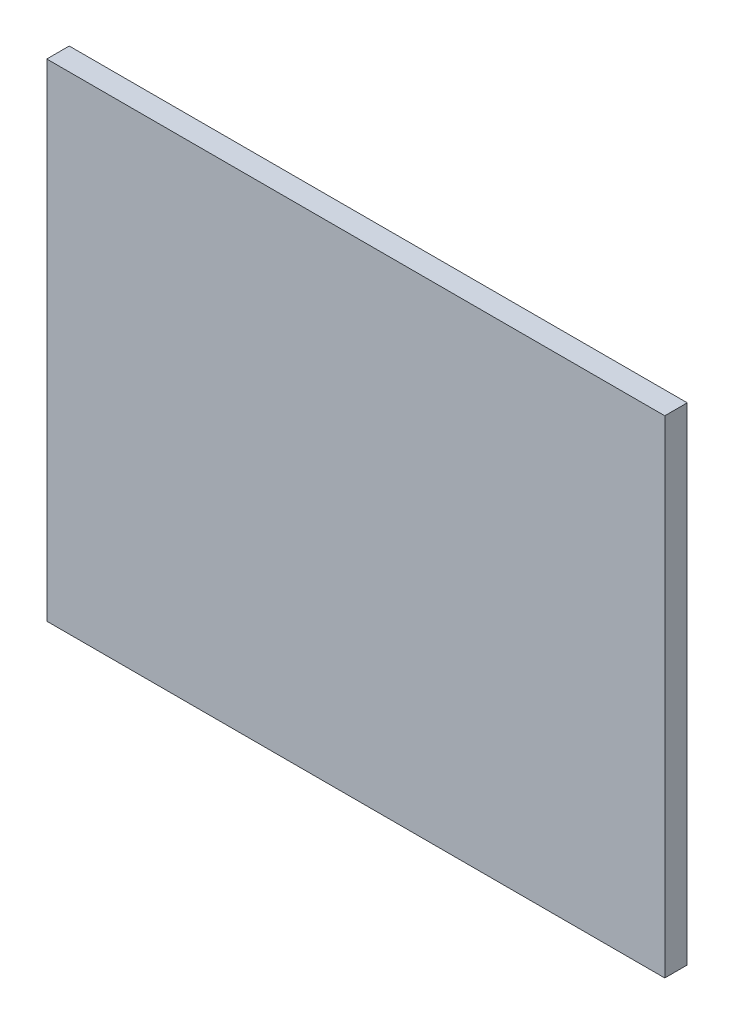
from build123d import *

# Parameters (mm, degrees)
SKETCH1_W           = 82.5
SKETCH1_H           = 65
BOSS_EXTRUDE1_DEPTH = 1.5
SKETCH2_W           = 75.322744119
SKETCH2_H           = 56.205881557
SKETCH2_W_2         = 72.322744119
SKETCH2_H_2         = 53.205881557
CUT_EXTRUDE1_DEPTH  = 1.5


with BuildPart() as part:
    # Sketch1 → Boss-Extrude1 (new, symmetric)
    with BuildSketch(Plane.XY):
        with Locations((0.253524641, 0.760573924)):
            Rectangle(SKETCH1_W, SKETCH1_H)
    extrude(amount=BOSS_EXTRUDE1_DEPTH, both=True)

    # Sketch2 → Cut-Extrude1 (cut)
    with BuildSketch(Plane(origin=(0, 0, -1.5), x_dir=(-1, 0, 0), z_dir=(0, 0, -1))):
        with Locations((0.340133491, -0.002700818)):
            Rectangle(SKETCH2_W, SKETCH2_H)
        with Locations((0.340133491, -0.002700818)):
            Rectangle(SKETCH2_W_2, SKETCH2_H_2, mode=Mode.SUBTRACT)
    extrude(amount=-CUT_EXTRUDE1_DEPTH, mode=Mode.SUBTRACT)


solid = part.part
